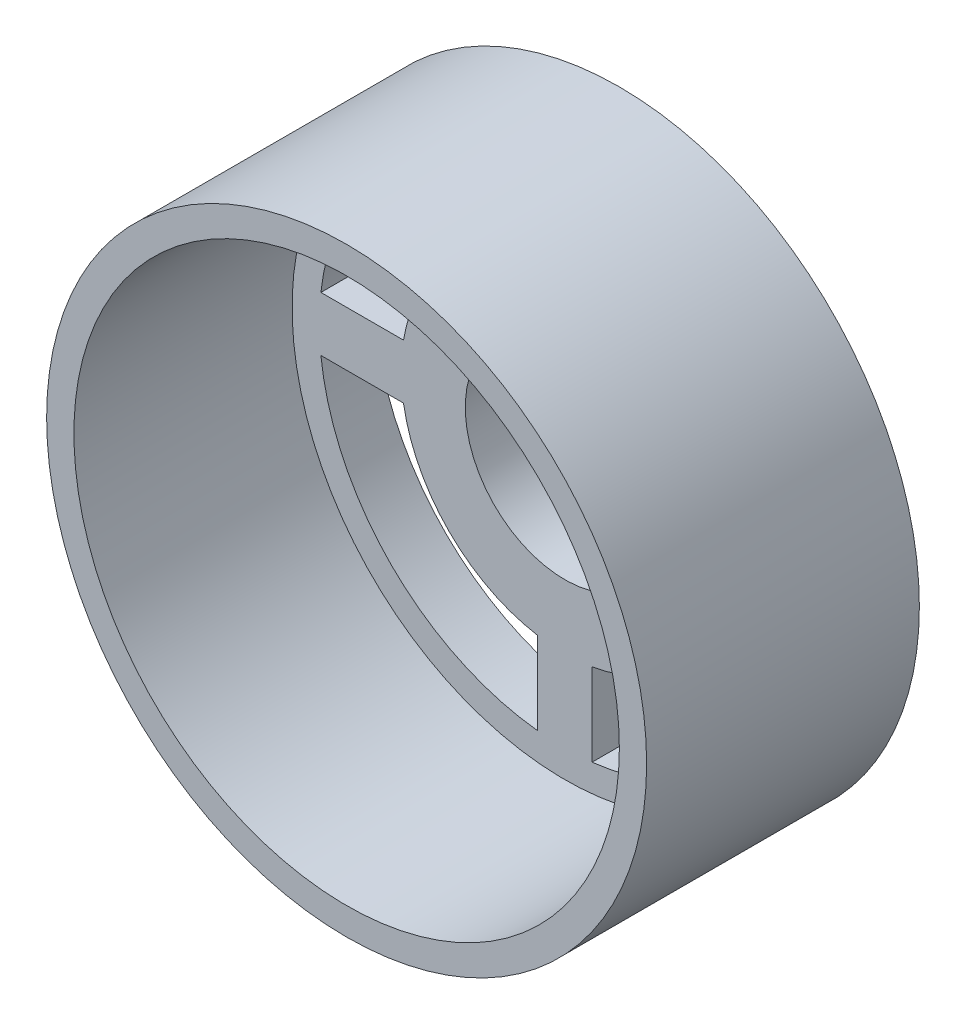
from build123d import *

# Parameters (mm, degrees)
ESBO_O1_R                = 10
ESBO_O1_R_2              = 3.65
RESSALTO_EXTRUS_O1_DEPTH = 2
ESBO_O2_R                = 11
ESBO_O2_R_2              = 10
RESSALTO_EXTRUS_O2_DEPTH = 10
CORTE_EXTRUS_O1_DEPTH    = 10


with BuildPart() as part:
    # Esboço1 → Ressalto-extrusão1 (new body)
    with BuildSketch(Plane.XY):
        Circle(ESBO_O1_R)
        Circle(ESBO_O1_R_2, mode=Mode.SUBTRACT)
    extrude(amount=RESSALTO_EXTRUS_O1_DEPTH)

    # Esboço2 → Ressalto-extrusão2 (add)
    with BuildSketch(Plane.XY):
        Circle(ESBO_O2_R)
        Circle(ESBO_O2_R_2, mode=Mode.SUBTRACT)
    extrude(amount=RESSALTO_EXTRUS_O2_DEPTH)

    # Esboço3 → Corte-extrusão1 (cut)
    with BuildSketch(Plane(origin=(0, 0, 0), x_dir=(-1, 0, 0), z_dir=(0, 0, -1))):
        with BuildLine():
            Line((-8.94427191, -1), (-6, -1))
            Line((-6, -1), (-5.916079783, -1))
            ThreePointArc((-5.916079783, -1), (-4.242640687, -4.242640687), (-1, -5.916079783))
            Line((-1, -5.916079783), (-1, -6))
            Line((-1, -6), (-1, -8.94427191))
            ThreePointArc((-1, -8.94427191), (-6.363961031, -6.363961031), (-8.94427191, -1))
        make_face()
        with BuildLine():
            Line((-8.94427191, 1), (-6, 1))
            Line((-6, 1), (-5.916079783, 1))
            ThreePointArc((-5.916079783, 1), (-4.242640687, 4.242640687), (-1, 5.916079783))
            Line((-1, 5.916079783), (-1, 6))
            Line((-1, 6), (-1, 8.94427191))
            ThreePointArc((-1, 8.94427191), (-6.363961031, 6.363961031), (-8.94427191, 1))
        make_face()
        with BuildLine():
            Line((1, 6), (1, 8.94427191))
            ThreePointArc((1, 8.94427191), (6.363961031, 6.363961031), (8.94427191, 1))
            Line((8.94427191, 1), (6, 1))
            Line((6, 1), (5.916079783, 1))
            ThreePointArc((5.916079783, 1), (4.242640687, 4.242640687), (1, 5.916079783))
            Line((1, 5.916079783), (1, 6))
        make_face()
        with BuildLine():
            Line((6, -1), (8.94427191, -1))
            ThreePointArc((8.94427191, -1), (6.363961031, -6.363961031), (1, -8.94427191))
            Line((1, -8.94427191), (1, -6))
            Line((1, -6), (1, -5.916079783))
            ThreePointArc((1, -5.916079783), (4.242640687, -4.242640687), (5.916079783, -1))
            Line((5.916079783, -1), (6, -1))
        make_face()
    extrude(amount=-CORTE_EXTRUS_O1_DEPTH, mode=Mode.SUBTRACT)


solid = part.part
